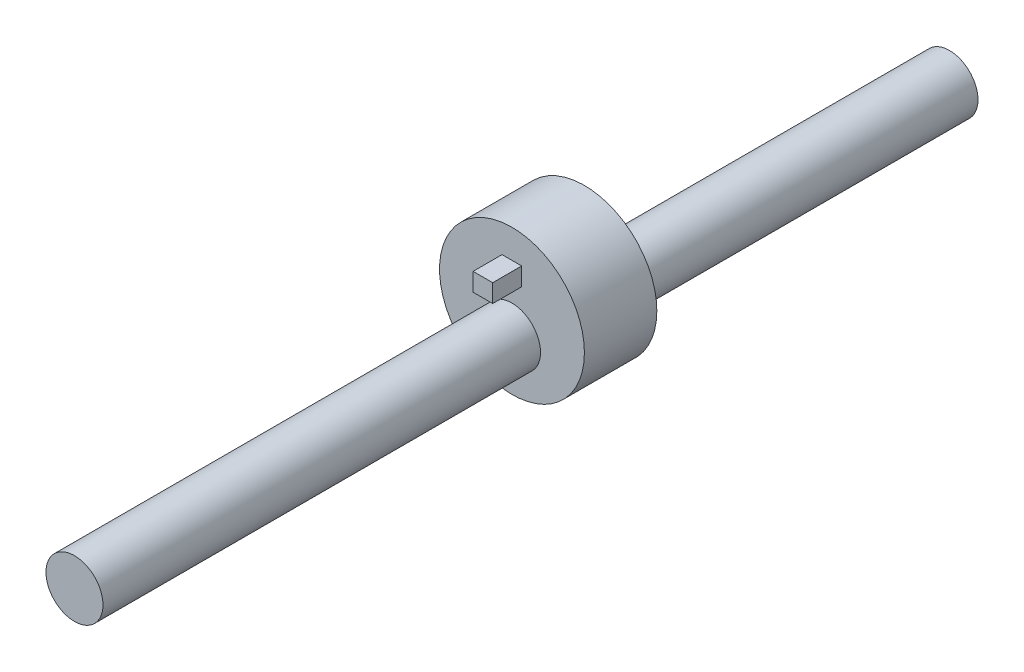
from build123d import *

# Parameters (mm, degrees)
SKETCH1_R           = 6.35
BOSS_EXTRUDE1_DEPTH = 6.35
SKETCH2_W           = 1.71989263
SKETCH2_H           = 1.584620177
BOSS_EXTRUDE2_DEPTH = 2.54
SKETCH3_R           = 2.499995
BOSS_EXTRUDE3_DEPTH = 38.354


with BuildPart() as part:
    # Sketch1 → Boss-Extrude1 (new body)
    with BuildSketch(Plane.XY):
        Circle(SKETCH1_R)
    extrude(amount=BOSS_EXTRUDE1_DEPTH)

    # Sketch2 → Boss-Extrude2 (add)
    with BuildSketch(Plane.XY.offset(6.35)):
        with Locations((-0.009662318, 3.043630217)):
            Rectangle(SKETCH2_W, SKETCH2_H)
    extrude(amount=BOSS_EXTRUDE2_DEPTH)

    # Sketch3 → Boss-Extrude3 (add, symmetric)
    with BuildSketch(Plane.XY.offset(6.35)):
        with Locations((0, -1.905)):
            Circle(SKETCH3_R)
    extrude(amount=BOSS_EXTRUDE3_DEPTH, both=True)


solid = part.part
